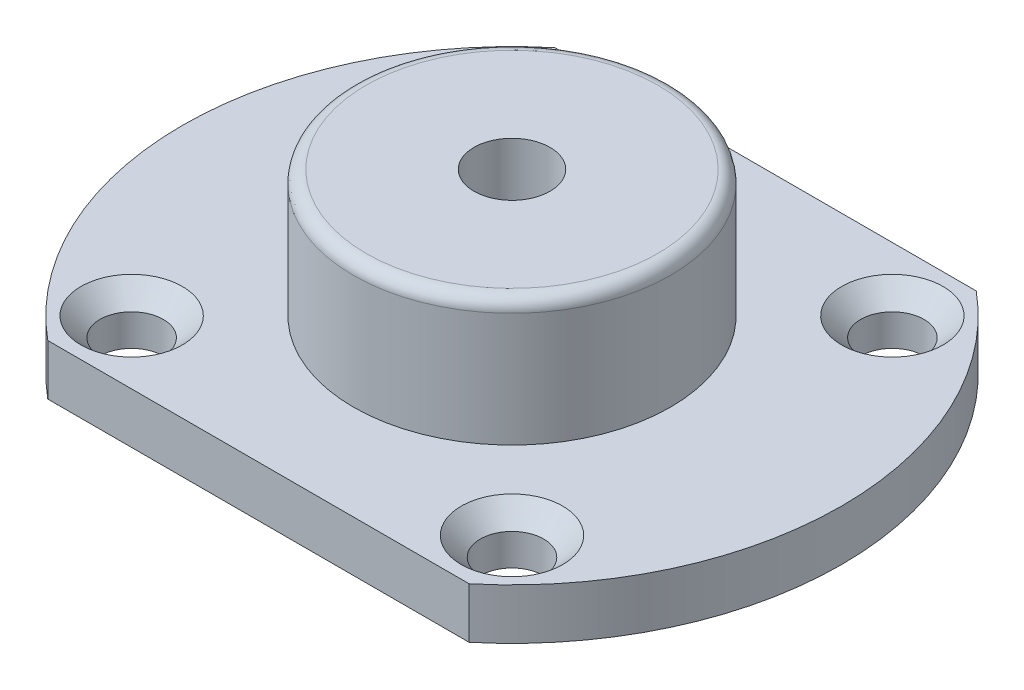
from build123d import *

# Parameters (mm, degrees)
SKETCH_1_R           = 26
EXTRUDE_1_DEPTH      = 4
SKETCH_2_OUTSIDE_W   = 68.73
SKETCH_2_OUTSIDE_H   = 68.73
SKETCH_2_OUTSIDE_W_2 = 65.720202688
SKETCH_2_OUTSIDE_H_2 = 40
CUT_EXTRUDE_1_DEPTH  = 4
SKETCH_3_R           = 12.5
EXTRUDE_2_DEPTH      = 10
FILLET_1_R           = 1
CUT_EXTRUDE_2_REACH  = 37.665
SKETCH_4_R           = 3
CUT_EXTRUDE_3_REACH  = 36.293
SKETCH_5_R           = 2.5
CHAMFER_1_SIZE       = 1.5


with BuildPart() as part:
    # Эскиз1 → Бобышка-Вытянуть1 (new body)
    with BuildSketch(Plane(origin=(0, 0, 0), x_dir=(1, 0, 0), z_dir=(0, 1, 0))):
        with Locations(Location((0, 0, 0), (0, 0, 270))):
            Circle(SKETCH_1_R)
    extrude(amount=EXTRUDE_1_DEPTH)

    # Эскиз2 outside → Вырез-Вытянуть1 (cut)
    with BuildSketch(Plane(origin=(0, 4, 0), x_dir=(1, 0, 0), z_dir=(0, 1, 0))):
        Rectangle(SKETCH_2_OUTSIDE_W, SKETCH_2_OUTSIDE_H)
        Rectangle(SKETCH_2_OUTSIDE_W_2, SKETCH_2_OUTSIDE_H_2, mode=Mode.SUBTRACT)
    extrude(amount=-CUT_EXTRUDE_1_DEPTH, mode=Mode.SUBTRACT)

    # Эскиз3 → Бобышка-Вытянуть2 (add)
    with BuildSketch(Plane(origin=(0, 4, 0), x_dir=(1, 0, 0), z_dir=(0, 1, 0))):
        with Locations(Location((0, 0, 0), (0, 0, 270))):
            Circle(SKETCH_3_R)
    extrude(amount=EXTRUDE_2_DEPTH)

    # Скругление1
    fillet_1_edges = [part.edges().sort_by_distance(p)[0] for p in [
        (0, 14, -12.5),
    ]]
    fillet(fillet_1_edges, radius=FILLET_1_R)

    # Эскиз4 → Вырез-Вытянуть2 (cut, up to next)
    with BuildSketch(Plane(origin=(0, 14, 0), x_dir=(1, 0, 0), z_dir=(0, 1, 0)), mode=Mode.PRIVATE) as cut_extrude_2_sk1:
        with Locations(Location((0, 0, 0), (0, 0, 270))):
            Circle(SKETCH_4_R)
    cut_extrude_2_tool1 = extrude(cut_extrude_2_sk1.sketch, amount=-CUT_EXTRUDE_2_REACH, mode=Mode.PRIVATE) & part.part
    add(cut_extrude_2_tool1.solids().sort_by_distance((0, 14, 0))[0], mode=Mode.SUBTRACT)

    # Эскиз5 → Вырез-Вытянуть3 (cut, up to next)
    with BuildSketch(Plane(origin=(0, 4, 0), x_dir=(1, 0, 0), z_dir=(0, 1, 0)), mode=Mode.PRIVATE) as cut_extrude_3_sk1:
        with Locations(Location((-15, 15, 0), (0, 0, 270))):
            Circle(SKETCH_5_R)
    cut_extrude_3_tool1 = extrude(cut_extrude_3_sk1.sketch, amount=-CUT_EXTRUDE_3_REACH, mode=Mode.PRIVATE) & part.part
    # Эскиз5 → Вырез-Вытянуть3 (cut, up to next)
    with BuildSketch(Plane(origin=(0, 4, 0), x_dir=(1, 0, 0), z_dir=(0, 1, 0)), mode=Mode.PRIVATE) as cut_extrude_3_sk2:
        with Locations(Location((15, 15, 0), (0, 0, 270))):
            Circle(SKETCH_5_R)
    cut_extrude_3_tool2 = extrude(cut_extrude_3_sk2.sketch, amount=-CUT_EXTRUDE_3_REACH, mode=Mode.PRIVATE) & part.part
    # Эскиз5 → Вырез-Вытянуть3 (cut, up to next)
    with BuildSketch(Plane(origin=(0, 4, 0), x_dir=(1, 0, 0), z_dir=(0, 1, 0)), mode=Mode.PRIVATE) as cut_extrude_3_sk3:
        with Locations(Location((15, -15, 0), (0, 0, 270))):
            Circle(SKETCH_5_R)
    cut_extrude_3_tool3 = extrude(cut_extrude_3_sk3.sketch, amount=-CUT_EXTRUDE_3_REACH, mode=Mode.PRIVATE) & part.part
    # Эскиз5 → Вырез-Вытянуть3 (cut, up to next)
    with BuildSketch(Plane(origin=(0, 4, 0), x_dir=(1, 0, 0), z_dir=(0, 1, 0)), mode=Mode.PRIVATE) as cut_extrude_3_sk4:
        with Locations(Location((-15, -15, 0), (0, 0, 270))):
            Circle(SKETCH_5_R)
    cut_extrude_3_tool4 = extrude(cut_extrude_3_sk4.sketch, amount=-CUT_EXTRUDE_3_REACH, mode=Mode.PRIVATE) & part.part
    add(cut_extrude_3_tool1.solids().sort_by_distance((-15, 4, -15))[0], mode=Mode.SUBTRACT)
    add(cut_extrude_3_tool2.solids().sort_by_distance((15, 4, -15))[0], mode=Mode.SUBTRACT)
    add(cut_extrude_3_tool3.solids().sort_by_distance((15, 4, 15))[0], mode=Mode.SUBTRACT)
    add(cut_extrude_3_tool4.solids().sort_by_distance((-15, 4, 15))[0], mode=Mode.SUBTRACT)

    # Фаска1
    chamfer_1_edges = [part.edges().sort_by_distance(p)[0] for p in [
        (-15, 4, 12.5),
        (15, 4, 12.5),
        (15, 4, -17.5),
        (-15, 4, -17.5),
    ]]
    chamfer(chamfer_1_edges, length=CHAMFER_1_SIZE)


solid = part.part
